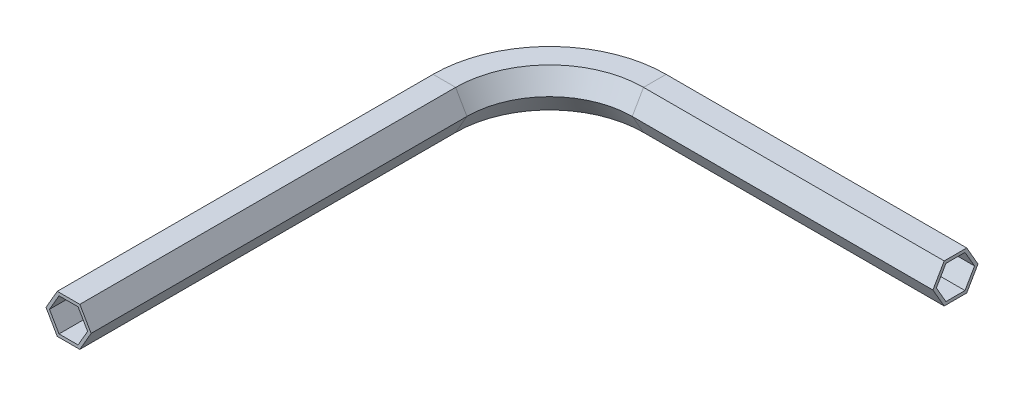
from build123d import *


with BuildPart() as part:
    # Balayage1: sweep along a path in Esquisse3
    with BuildLine(Plane(origin=(0, 0, 0), x_dir=(1, 0, 0), z_dir=(0, 1, 0))) as balayage1_path:
        Line((0, 0), (0, 2500))
        ThreePointArc((0, 2500), (205.025253169, 2994.974746831), (700, 3200))
        Line((700, 3200), (2700, 3200))
    # Esquisse2 → Balayage1 (sweep)
    with BuildSketch(Plane.XY):
        Polygon((75, 129.903810568), (-75, 129.903810568), (-150, 0), (-75, -129.903810568), (75, -129.903810568), (150, 0), align=None)
    sweep(path=balayage1_path.line)

    # Enlèvement de matière-Balayage1: sweep along a path in Esquisse5
    with BuildLine(Plane(origin=(0, 129.903810568, 0), x_dir=(1, 0, 0), z_dir=(0, 1, 0))) as enl_vement_de_mati_re_balayage1_path:
        Line((150, 0), (150, 2500))
        ThreePointArc((150, 2500), (311.091270347, 2888.908729653), (700, 3050))
        Line((700, 3050), (2700, 3050))
    # Esquisse4 → Enlèvement de matière-Balayage1 (sweep, cut)
    with BuildSketch(Plane.XY):
        Polygon((126.905989232, 0), (63.452994616, 109.903810568), (-63.452994616, 109.903810568), (-126.905989232, 0), (-63.452994616, -109.903810568), (63.452994616, -109.903810568), align=None)
    sweep(path=enl_vement_de_mati_re_balayage1_path.line, mode=Mode.SUBTRACT)


solid = part.part
